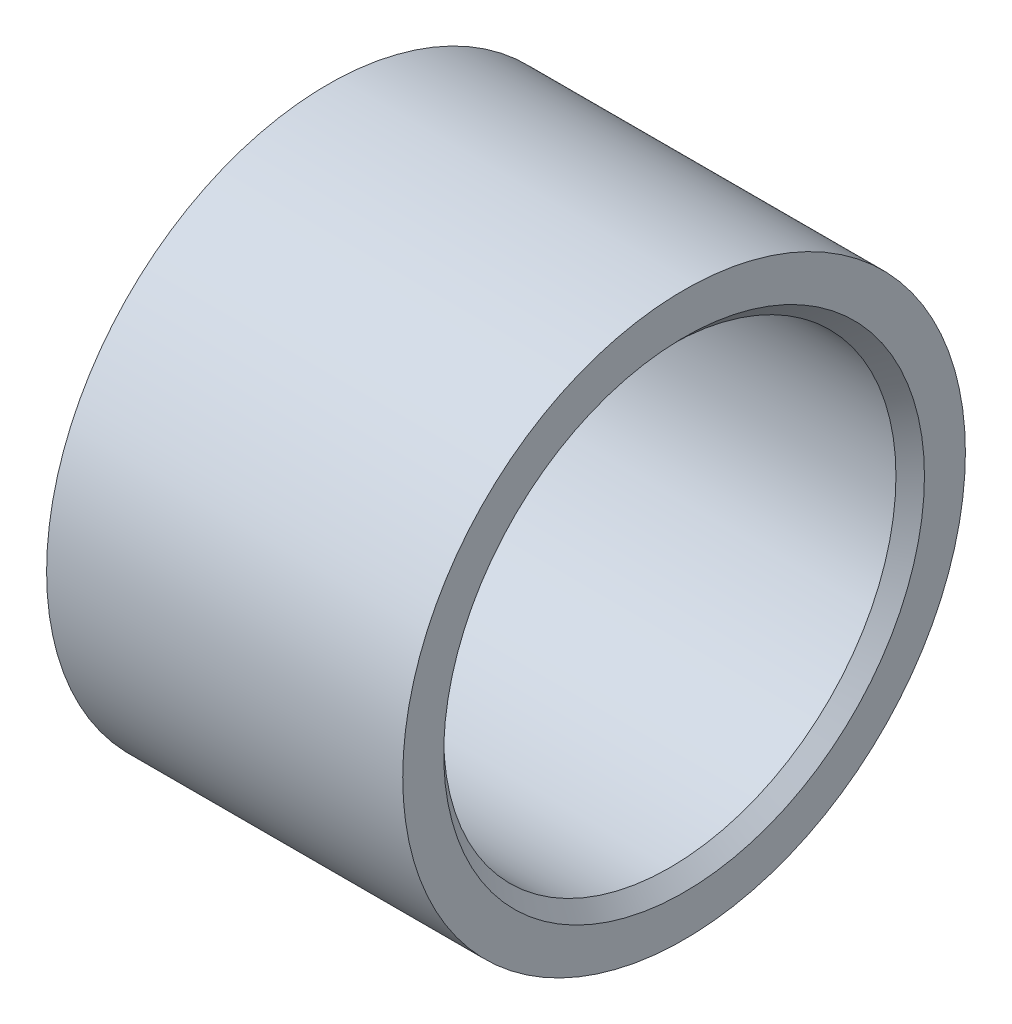
from build123d import *

# Parameters (mm, degrees)
BOSS_EXTRUDE1_START = 52.216112
SKETCH1_R           = 10.033
SKETCH1_R_2         = 8.0645
BOSS_EXTRUDE1_DEPTH = 12.7
CHAMFER1_SIZE       = 0.508


with BuildPart() as part:
    # Sketch1 → Boss-Extrude1 (new body)
    with BuildSketch(Plane(origin=(0, 0, 0), x_dir=(0, 0, -1), z_dir=(1, 0, 0)).offset(BOSS_EXTRUDE1_START)):
        with Locations((-1400.10094117, 313.555090566)):
            Circle(SKETCH1_R)
        with Locations((-1400.10094117, 313.555090566)):
            Circle(SKETCH1_R_2, mode=Mode.SUBTRACT)
    extrude(amount=BOSS_EXTRUDE1_DEPTH)

    # Chamfer1
    chamfer1_edges = [part.edges().sort_by_distance(p)[0] for p in [
        (52.216112, 313.555090566, 1408.16544117),
        (64.916112, 313.555090566, 1408.16544117),
    ]]
    chamfer(chamfer1_edges, length=CHAMFER1_SIZE)


solid = part.part
